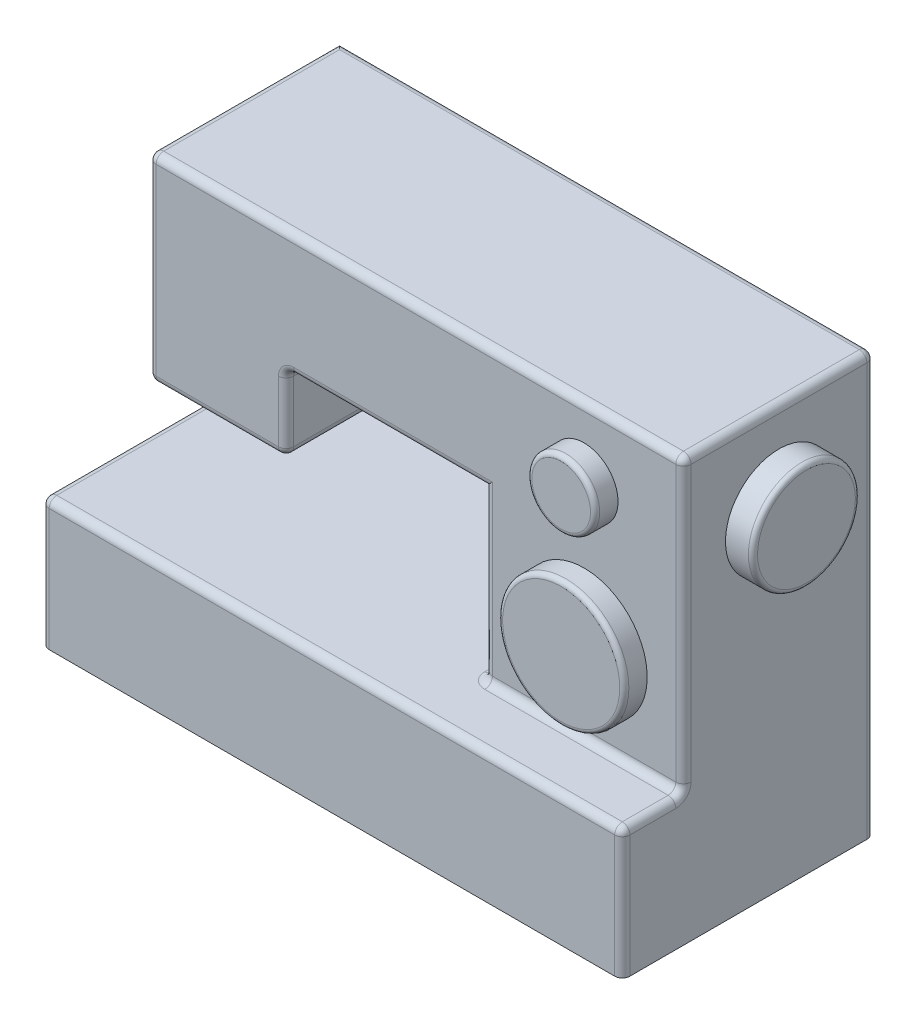
from build123d import *

# Parameters (mm, degrees)
SKETCH1_W           = 380
SKETCH1_H           = 165
BOSS_EXTRUDE1_DEPTH = 85
SKETCH2_W           = 130
SKETCH2_H           = 125
BOSS_EXTRUDE2_DEPTH = 190
BOSS_EXTRUDE3_DEPTH = 125
SKETCH5_R           = 35
BOSS_EXTRUDE4_DEPTH = 18
FILLET1_R           = 5
SKETCH6_R           = 22.201098979
SKETCH6_R_2         = 41.299501956
BOSS_EXTRUDE5_DEPTH = 15
FILLET2_R           = 3


with BuildPart() as part:
    # Sketch1 → Boss-Extrude1 (new body)
    with BuildSketch(Plane(origin=(0, 0, 0), x_dir=(1, 0, 0), z_dir=(0, 1, 0))):
        Rectangle(SKETCH1_W, SKETCH1_H)
    extrude(amount=BOSS_EXTRUDE1_DEPTH)

    # Sketch2 → Boss-Extrude2 (add)
    with BuildSketch(Plane(origin=(0, 85, 0), x_dir=(1, 0, 0), z_dir=(0, 1, 0))):
        with Locations((125, 20)):
            Rectangle(SKETCH2_W, SKETCH2_H)
    extrude(amount=BOSS_EXTRUDE2_DEPTH)

    # Sketch3 → Boss-Extrude3 (add)
    with BuildSketch(Plane(origin=(0, 0, -82.5), x_dir=(-1, 0, 0), z_dir=(0, 0, -1))):
        Polygon((-60, 275), (160, 275), (160, 145), (70, 145), (70, 195), (-60, 195), align=None)
    extrude(amount=-BOSS_EXTRUDE3_DEPTH)

    # Sketch5 → Boss-Extrude4 (add)
    with BuildSketch(Plane(origin=(190, 0, 0), x_dir=(0, 0, -1), z_dir=(1, 0, 0))):
        with Locations(Location((20, 215, 0), (0, 0, 180))):
            Circle(SKETCH5_R)
    extrude(amount=BOSS_EXTRUDE4_DEPTH)

    # Fillet1
    fillet1_edges = [part.edges().sort_by_distance(p)[0] for p in [
        (-190, 85, 0),
        (-65, 85, -82.5),
        (190, 180, 42.5),
        (60, 85, -20),
        (0, 85, 82.5),
        (125, 85, 42.5),
        (190, 275, -20),
        (15, 275, -82.5),
        (15, 275, 42.5),
        (60, 140, 42.5),
        (60, 140, -82.5),
        (-160, 275, -20),
        (-160, 145, -20),
        (-70, 145, -20),
        (-70, 195, -20),
        (-5, 195, -82.5),
        (-70, 170, -82.5),
        (-115, 145, -82.5),
        (-160, 210, 42.5),
        (-115, 145, 42.5),
        (-70, 170, 42.5),
        (-5, 195, 42.5),
        (190, 85, 62.5),
        (190, 42.5, 82.5),
        (-190, 42.5, 82.5),
        (-190, 42.5, -82.5),
        (190, 137.5, -82.5),
    ]]
    fillet(fillet1_edges, radius=FILLET1_R)

    # Sketch6 → Boss-Extrude5 (add)
    with BuildSketch(Plane.XY.offset(42.5)):
        with Locations(Location((125, 230, 0), (0, 0, 180))):
            Circle(SKETCH6_R)
        with Locations(Location((125, 140, 0), (0, 0, 180))):
            Circle(SKETCH6_R_2)
    extrude(amount=BOSS_EXTRUDE5_DEPTH)

    # Fillet2
    fillet2_edges = [part.edges().sort_by_distance(p)[0] for p in [
        (147.201098979, 230, 57.5),
        (166.299501956, 140, 57.5),
        (208, 215, -55),
    ]]
    fillet(fillet2_edges, radius=FILLET2_R)


solid = part.part
